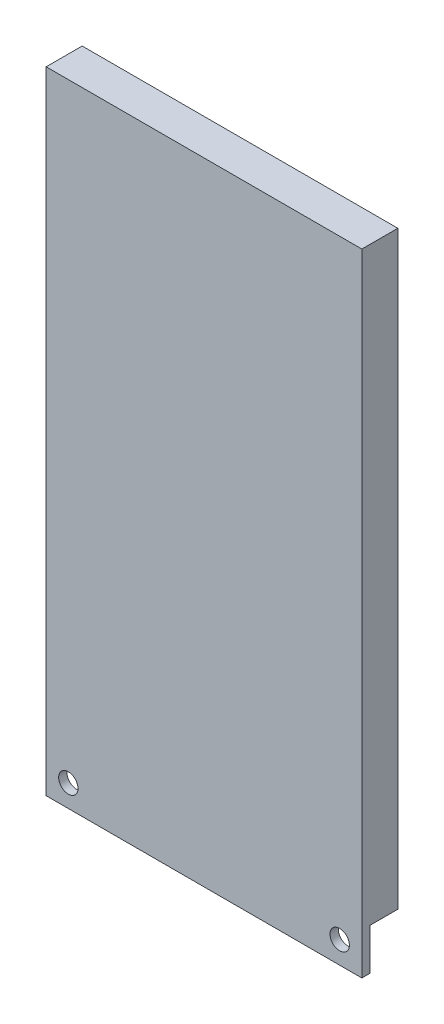
from build123d import *

# Parameters (mm, degrees)
ESQUISSE1_W             = 57
ESQUISSE1_H             = 114
BOSS_EXTRU_1_DEPTH      = 1.5
ESQUISSE3_R             = 1.75
ESQUISSE3_W             = 57
ESQUISSE3_H             = 106.5
ESQUISSE3_W_2           = 53
ESQUISSE3_H_2           = 102.5
BOSS_EXTRU_2_DEPTH      = 5
ENL_V_START             = -12
ESQUISSE4_R             = 1.75
ENL_V_MAT_EXTRU_1_DEPTH = 12


with BuildPart() as part:
    # Esquisse1 → Boss.-Extru.1 (new body)
    with BuildSketch(Plane.XY):
        with Locations((28.5, 57)):
            Rectangle(ESQUISSE1_W, ESQUISSE1_H)
    extrude(amount=BOSS_EXTRU_1_DEPTH)

    # Esquisse3 → Boss.-Extru.2 (add)
    # profile 1 of 3: a face of its own
    with BuildSketch(Plane(origin=(0, 0, 0), x_dir=(-1, 0, 0), z_dir=(0, 0, -1))):
        with Locations((-4, 4)):
            Circle(ESQUISSE3_R)
    # profile 2 of 3: a face of its own
    with BuildSketch(Plane(origin=(0, 0, 0), x_dir=(-1, 0, 0), z_dir=(0, 0, -1))):
        with Locations((-53, 4)):
            Circle(ESQUISSE3_R)
    # profile 3 of 3: a face of its own
    with BuildSketch(Plane(origin=(0, 0, 0), x_dir=(-1, 0, 0), z_dir=(0, 0, -1))):
        with Locations((-28.5, 60.75)):
            Rectangle(ESQUISSE3_W, ESQUISSE3_H)
        with Locations((-28.5, 60.75)):
            Rectangle(ESQUISSE3_W_2, ESQUISSE3_H_2, mode=Mode.SUBTRACT)
    extrude(amount=BOSS_EXTRU_2_DEPTH)

    # Esquisse4 → Enlèv. mat.-Extru.1 (cut)
    with BuildSketch(Plane(origin=(0, 0, -5), x_dir=(-1, 0, 0), z_dir=(0, 0, -1)).offset(ENL_V_START)):
        with Locations((-4, 4)):
            Circle(ESQUISSE4_R)
        with Locations((-53, 4)):
            Circle(ESQUISSE4_R)
    extrude(amount=ENL_V_MAT_EXTRU_1_DEPTH, mode=Mode.SUBTRACT)


solid = part.part
